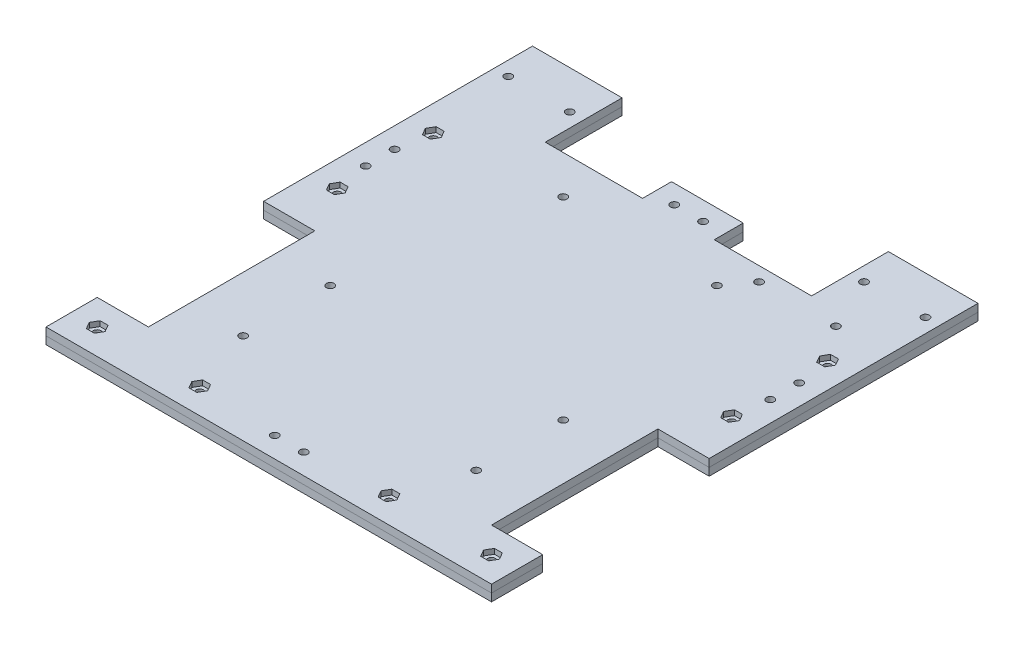
from build123d import *

# Parameters (mm, degrees)
CROQUIS1_W              = 35
CROQUIS1_H              = 30
SALIENTE_EXTRUIR1_DEPTH = 7
CORTAR_EXTRUIR1_DEPTH   = 2
CORTAR_EXTRUIR2_DEPTH   = 2
CROQUIS5_R              = 1.5
CORTAR_EXTRUIR5_DEPTH   = 12
CORTAR_EXTRUIR6_DEPTH   = 2
CROQUIS8_R              = 1.5
CORTAR_EXTRUIR7_DEPTH   = 5
CROQUIS10_R             = 1.5
CORTAR_EXTRUIR9_DEPTH   = 24
CROQUIS11_R             = 1.5
CORTAR_EXTRUIR10_DEPTH  = 24
CROQUIS12_R             = 1.5
CORTAR_EXTRUIR11_DEPTH  = 24
CROQUIS13_R             = 1.5
CORTAR_EXTRUIR12_DEPTH  = 11
CROQUIS14_W             = 28
CROQUIS14_H             = 7
SALIENTE_EXTRUIR2_DEPTH = 11.3
CROQUIS15_R             = 1.5
CORTAR_EXTRUIR13_DEPTH  = 11.3
CROQUIS16_R             = 1.5
CORTAR_EXTRUIR14_DEPTH  = 11.3
CROQUIS17_R             = 1.5
CORTAR_EXTRUIR15_DEPTH  = 11.3
CROQUIS18_W             = 190
CROQUIS18_H             = 1
CORTAR_EXTRUIR17_DEPTH  = 1000


with BuildPart() as part:
    # Croquis1 → Saliente-Extruir1 (new body)
    with BuildSketch(Plane(origin=(0, 0, 0), x_dir=(1, 0, 0), z_dir=(0, 1, 0))):
        Polygon((-87, -80), (87, -80), (87, -60), (67, -60), (67, 5), (87, 5), (87, 80), (52, 80), (-52, 80), (-87, 80), (-87, 5), (-67, 5), (-67, -60), (-87, -60), align=None)
        with Locations((69.5, 95)):
            Rectangle(CROQUIS1_W, CROQUIS1_H)
        with Locations((-69.5, 95)):
            Rectangle(CROQUIS1_W, CROQUIS1_H)
    extrude(amount=SALIENTE_EXTRUIR1_DEPTH)

    # Croquis3 → Cortar-Extruir1 (cut)
    with BuildSketch(Plane(origin=(0, 7, 0), x_dir=(1, 0, 0), z_dir=(0, 1, 0))):
        Polygon((-80.1, -70), (-78.55, -72.684678752), (-75.45, -72.684678752), (-73.9, -70), (-75.45, -67.315321248), (-78.55, -67.315321248), align=None)
        Polygon((-80.1, 61.25), (-78.55, 58.565321248), (-75.45, 58.565321248), (-73.9, 61.25), (-75.45, 63.934678752), (-78.55, 63.934678752), align=None)
        Polygon((-73.9, 23.75), (-75.45, 26.434678752), (-78.55, 26.434678752), (-80.1, 23.75), (-78.55, 21.065321248), (-75.45, 21.065321248), align=None)
        Polygon((78.55, 63.934678752), (80.1, 61.25), (78.55, 58.565321248), (75.45, 58.565321248), (73.9, 61.25), (75.45, 63.934678752), align=None)
        Polygon((75.45, 21.065321248), (73.9, 23.75), (75.45, 26.434678752), (78.55, 26.434678752), (80.1, 23.75), (78.55, 21.065321248), align=None)
        Polygon((78.55, -67.315321248), (80.1, -70), (78.55, -72.684678752), (75.45, -72.684678752), (73.9, -70), (75.45, -67.315321248), align=None)
    extrude(amount=-CORTAR_EXTRUIR1_DEPTH, mode=Mode.SUBTRACT)

    # Croquis4 → Cortar-Extruir2 (cut)
    with BuildSketch(Plane.XZ):
        Polygon((-78.55, 67.315321248), (-80.1, 70), (-78.55, 72.684678752), (-75.45, 72.684678752), (-73.9, 70), (-75.45, 67.315321248), align=None)
        Polygon((-75.45, -21.065321248), (-73.9, -23.75), (-75.45, -26.434678752), (-78.55, -26.434678752), (-80.1, -23.75), (-78.55, -21.065321248), align=None)
        Polygon((-78.55, -63.934678752), (-80.1, -61.25), (-78.55, -58.565321248), (-75.45, -58.565321248), (-73.9, -61.25), (-75.45, -63.934678752), align=None)
        Polygon((78.55, -63.934678752), (75.45, -63.934678752), (73.9, -61.25), (75.45, -58.565321248), (78.55, -58.565321248), (80.1, -61.25), align=None)
        Polygon((75.45, -21.065321248), (78.55, -21.065321248), (80.1, -23.75), (78.55, -26.434678752), (75.45, -26.434678752), (73.9, -23.75), align=None)
        Polygon((78.55, 67.315321248), (75.45, 67.315321248), (73.9, 70), (75.45, 72.684678752), (78.55, 72.684678752), (80.1, 70), align=None)
        Polygon((40.05, 70), (38.5, 72.684678752), (35.4, 72.684678752), (33.85, 70), (35.4, 67.315321248), (38.5, 67.315321248), align=None)
        Polygon((-33.85, 70), (-35.4, 72.684678752), (-38.5, 72.684678752), (-40.05, 70), (-38.5, 67.315321248), (-35.4, 67.315321248), align=None)
    extrude(amount=-CORTAR_EXTRUIR2_DEPTH, mode=Mode.SUBTRACT)

    # Croquis5 → Cortar-Extruir5 (cut)
    with BuildSketch(Plane(origin=(0, 7, 0), x_dir=(1, 0, 0), z_dir=(0, 1, 0))):
        with Locations(Location((77, 23.75, 0), (0, 0, 270))):
            Circle(CROQUIS5_R)
        with Locations(Location((77, 61.25, 0), (0, 0, 270))):
            Circle(CROQUIS5_R)
        with Locations(Location((-77, 61.25, 0), (0, 0, 270))):
            Circle(CROQUIS5_R)
        with Locations(Location((-77, 23.75, 0), (0, 0, 270))):
            Circle(CROQUIS5_R)
        with Locations(Location((-77, -70, 0), (0, 0, 270))):
            Circle(CROQUIS5_R)
        with Locations(Location((77, -70, 0), (0, 0, 270))):
            Circle(CROQUIS5_R)
    extrude(amount=-CORTAR_EXTRUIR5_DEPTH, mode=Mode.SUBTRACT)

    # Croquis7 → Cortar-Extruir6 (cut)
    with BuildSketch(Plane(origin=(0, 7, 0), x_dir=(1, 0, 0), z_dir=(0, 1, 0))):
        Polygon((-38.5, -67.315321248), (-35.4, -67.315321248), (-33.85, -70), (-35.4, -72.684678752), (-38.5, -72.684678752), (-40.05, -70), align=None)
        Polygon((35.4, -67.315321248), (38.5, -67.315321248), (40.05, -70), (38.5, -72.684678752), (35.4, -72.684678752), (33.85, -70), align=None)
    extrude(amount=-CORTAR_EXTRUIR6_DEPTH, mode=Mode.SUBTRACT)

    # Croquis8 → Cortar-Extruir7 (cut)
    with BuildSketch(Plane.XZ.offset(-2)):
        with Locations(Location((36.95, 70, 0), (0, 0, 270))):
            Circle(CROQUIS8_R)
        with Locations(Location((-36.95, 70, 0), (0, 0, 270))):
            Circle(CROQUIS8_R)
    extrude(amount=-CORTAR_EXTRUIR7_DEPTH, mode=Mode.SUBTRACT)

    # Croquis10 → Cortar-Extruir9 (cut)
    with BuildSketch(Plane.XZ):
        with Locations(Location((-81.468747974, -95, 0), (0, 0, 270))):
            Circle(CROQUIS10_R)
        with Locations(Location((-57.468747974, -95, 0), (0, 0, 270))):
            Circle(CROQUIS10_R)
        with Locations(Location((57.468747974, -95, 0), (0, 0, 90))):
            Circle(CROQUIS10_R)
        with Locations(Location((81.468747974, -95, 0), (0, 0, 270))):
            Circle(CROQUIS10_R)
    extrude(amount=-CORTAR_EXTRUIR9_DEPTH, mode=Mode.SUBTRACT)

    # Croquis11 → Cortar-Extruir10 (cut)
    with BuildSketch(Plane(origin=(0, 0, 0), x_dir=(-1, 0, 0), z_dir=(0, -1, 0))):
        with Locations(Location((30, 65, 0), (0, 0, 90))):
            Circle(CROQUIS11_R)
        with Locations(Location((-30, 65, 0), (0, 0, 270))):
            Circle(CROQUIS11_R)
    extrude(amount=-CORTAR_EXTRUIR10_DEPTH, mode=Mode.SUBTRACT)

    # Croquis12 → Cortar-Extruir11 (cut)
    with BuildSketch(Plane.XZ):
        with Locations(Location((45.5, 44.5, 0), (0, 0, 270))):
            Circle(CROQUIS12_R)
        with Locations(Location((-45.5, 44.5, 0), (0, 0, 270))):
            Circle(CROQUIS12_R)
        with Locations(Location((-45.5, 10.5, 0), (0, 0, 270))):
            Circle(CROQUIS12_R)
        with Locations(Location((45.5, 10.5, 0), (0, 0, 90))):
            Circle(CROQUIS12_R)
    extrude(amount=-CORTAR_EXTRUIR11_DEPTH, mode=Mode.SUBTRACT)

    # Croquis13 → Cortar-Extruir12 (cut)
    with BuildSketch(Plane(origin=(0, 7, 0), x_dir=(1, 0, 0), z_dir=(0, 1, 0))):
        with Locations(Location((37, 74.5, 0), (0, 0, 270))):
            Circle(CROQUIS13_R)
        with Locations(Location((67, 74.5, 0), (0, 0, 270))):
            Circle(CROQUIS13_R)
    extrude(amount=-CORTAR_EXTRUIR12_DEPTH, mode=Mode.SUBTRACT)

    # Croquis14 → Saliente-Extruir2 (add)
    with BuildSketch(Plane(origin=(0, 0, -80), x_dir=(-1, 0, 0), z_dir=(0, 0, -1))):
        with Locations((0, 3.5)):
            Rectangle(CROQUIS14_W, CROQUIS14_H)
    extrude(amount=SALIENTE_EXTRUIR2_DEPTH)

    # Croquis15 → Cortar-Extruir13 (cut)
    with BuildSketch(Plane(origin=(0, 7, 0), x_dir=(1, 0, 0), z_dir=(0, 1, 0))):
        with Locations(Location((-5.65, 84, 0), (0, 0, 270))):
            Circle(CROQUIS15_R)
        with Locations(Location((5.65, 84, 0), (0, 0, 270))):
            Circle(CROQUIS15_R)
    extrude(amount=-CORTAR_EXTRUIR13_DEPTH, mode=Mode.SUBTRACT)

    # Croquis16 → Cortar-Extruir14 (cut)
    with BuildSketch(Plane(origin=(0, 7, 0), x_dir=(1, 0, 0), z_dir=(0, 1, 0))):
        with Locations(Location((-79, 48.15, 0), (0, 0, 270))):
            Circle(CROQUIS16_R)
        with Locations(Location((-79, 36.85, 0), (0, 0, 270))):
            Circle(CROQUIS16_R)
        with Locations(Location((79, 36.85, 0), (0, 0, 270))):
            Circle(CROQUIS16_R)
        with Locations(Location((79, 48.15, 0), (0, 0, 270))):
            Circle(CROQUIS16_R)
    extrude(amount=-CORTAR_EXTRUIR14_DEPTH, mode=Mode.SUBTRACT)

    # Croquis17 → Cortar-Extruir15 (cut)
    with BuildSketch(Plane(origin=(0, 7, 0), x_dir=(1, 0, 0), z_dir=(0, 1, 0))):
        with Locations(Location((5.65, -72, 0), (0, 0, 270))):
            Circle(CROQUIS17_R)
        with Locations(Location((-5.65, -72, 0), (0, 0, 270))):
            Circle(CROQUIS17_R)
    extrude(amount=-CORTAR_EXTRUIR15_DEPTH, mode=Mode.SUBTRACT)

    # Croquis18 → Cortar-Extruir17 (cut)
    with BuildSketch(Plane.ZY.offset(87)):
        with Locations((-15, 3.5)):
            Rectangle(CROQUIS18_W, CROQUIS18_H)
    extrude(amount=-CORTAR_EXTRUIR17_DEPTH, mode=Mode.SUBTRACT)


with BuildPart() as cortar_extruir17_piece_1:
    # of the separate pieces the step leaves, piece 1, a body of its own (cortar_extruir17_pieces)
    add(part.part.solids().sort_by_distance((-87, 0, 60))[0])


with BuildPart() as cortar_extruir17_piece_2:
    # of the separate pieces the step leaves, piece 2, a body of its own (cortar_extruir17_pieces)
    add(part.part.solids().sort_by_distance((-87, 4, 80))[0])


with BuildPart() as cortar_extruir17_piece_1_1:
    # Sólido-Mover/Copiar1: moved
    add(cortar_extruir17_piece_1.part.moved(Location((0, 1, 0))))


solid = Compound([cortar_extruir17_piece_2.part, cortar_extruir17_piece_1_1.part])
